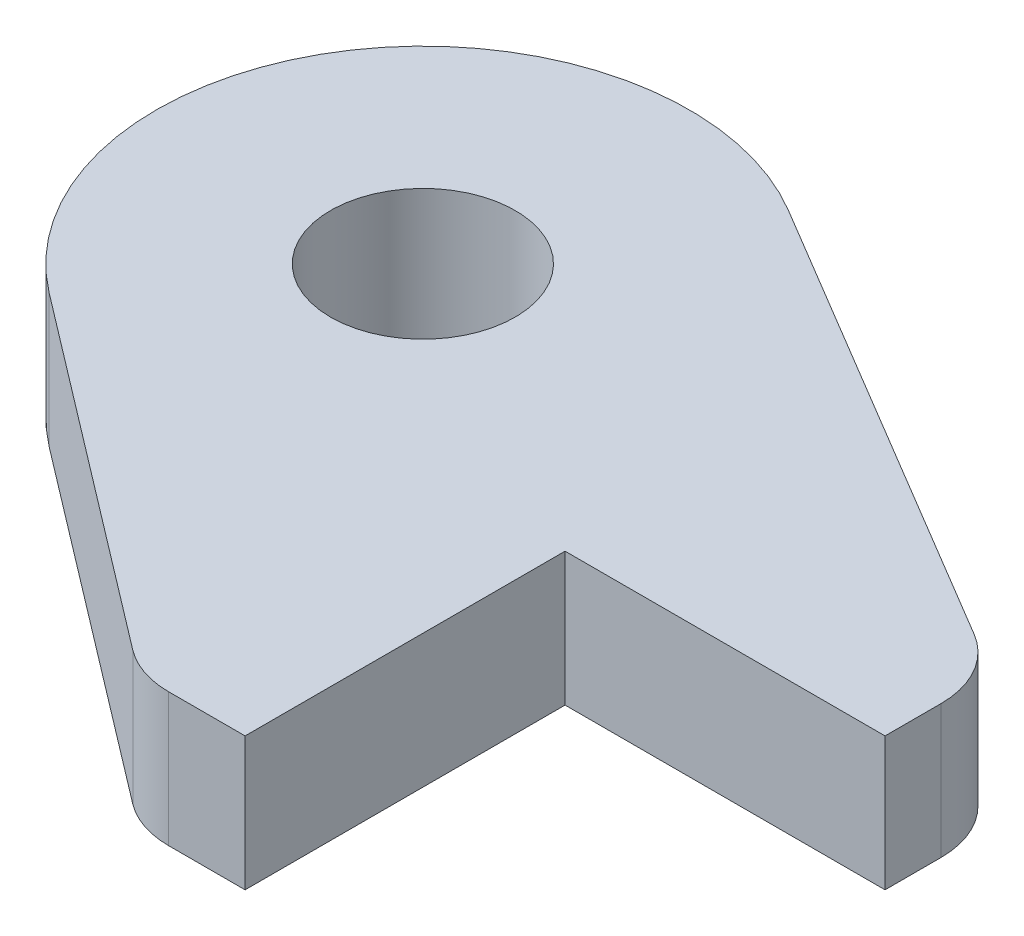
from build123d import *

# Parameters (mm, degrees)
BOSS_EXTRUDE1_DEPTH  = 4.7625
FILLET1_R            = 3.175
M6_CLEARANCE_HOLE1_D = 6.6


with BuildPart() as part:
    # Sketch1 → Boss-Extrude1 (new body)
    with BuildSketch(Plane(origin=(0, 0, 0), x_dir=(1, 0, 0), z_dir=(0, 1, 0))):
        with BuildLine():
            Line((-19.252221857, 27.231253289), (-1.27, 16.51))
            Line((-1.27, 16.51), (-1.27, 12.7))
            Line((-1.27, 12.7), (-12.7, 12.7))
            Line((-12.7, 12.7), (-12.7, 1.27))
            Line((-12.7, 1.27), (-16.51, 1.27))
            Line((-16.51, 1.27), (-29.902438631, 11.473419158))
            ThreePointArc((-29.902438631, 11.473419158), (-32.02160557, 24.383684142), (-19.252221857, 27.231253289))
        make_face()
    extrude(amount=BOSS_EXTRUDE1_DEPTH)

    # Fillet1
    fillet1_edges = [part.edges().sort_by_distance(p)[0] for p in [
        (-16.51, 2.38125, -1.27),
        (-1.27, 2.38125, -16.51),
    ]]
    fillet(fillet1_edges, radius=FILLET1_R)

    # M6 Clearance Hole1 (through all)
    with Locations(Plane(origin=(0, 4.7625, 0), x_dir=(1, 0, 0), z_dir=(0, 1, 0))):
        with Locations((-24.13, 19.05)):
            Hole(M6_CLEARANCE_HOLE1_D / 2)


solid = part.part
